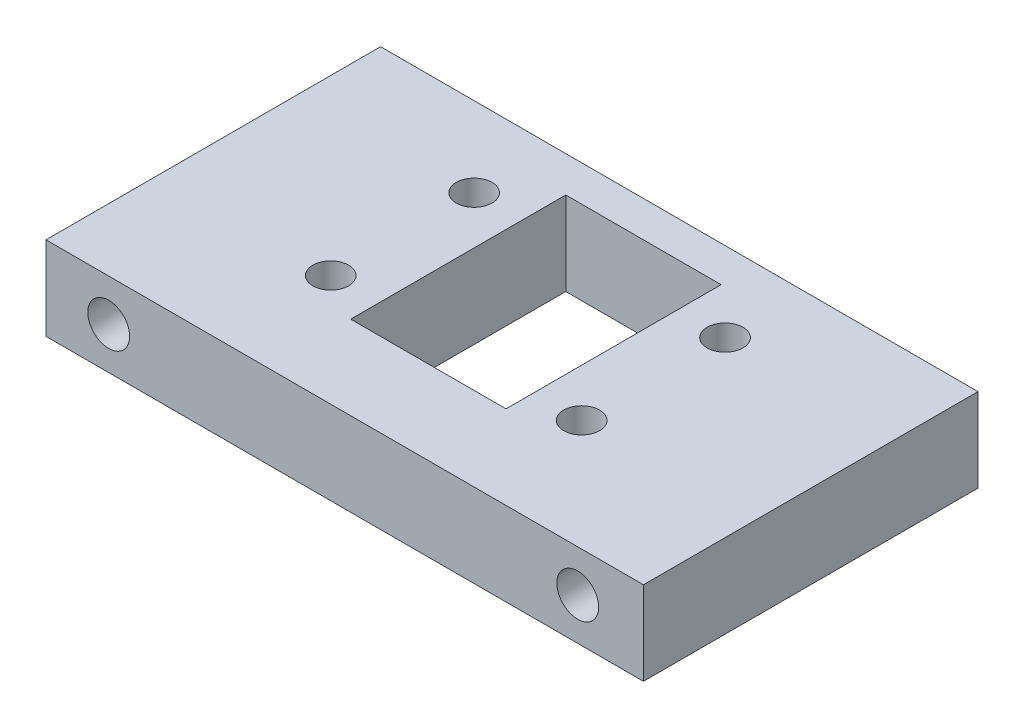
from build123d import *

# Parameters (mm, degrees)
ESQUISSE1_W             = 50
ESQUISSE1_H             = 7
BOSS_EXTRU_1_DEPTH      = 28
ESQUISSE2_R             = 1.75
ENL_V_MAT_EXTRU_2_DEPTH = 70
ESQUISSE3_R             = 1.5
ESQUISSE3_W             = 13
ESQUISSE3_H             = 18
ENL_V_MAT_EXTRU_3_DEPTH = 58.732140095


with BuildPart() as part:
    # Esquisse1 → Boss.-Extru.1 (new body)
    with BuildSketch(Plane.XY):
        with Locations((25, 3.5)):
            Rectangle(ESQUISSE1_W, ESQUISSE1_H)
    extrude(amount=BOSS_EXTRU_1_DEPTH)

    # Esquisse2 → Enlèv. mat.-Extru.2 (cut)
    with BuildSketch(Plane.XY.offset(28)):
        with Locations((5.25, 3.5)):
            Circle(ESQUISSE2_R)
        with Locations((44.5, 3.5)):
            Circle(ESQUISSE2_R)
    extrude(amount=-ENL_V_MAT_EXTRU_2_DEPTH, mode=Mode.SUBTRACT)

    # Esquisse3 → Enlèv. mat.-Extru.3 (cut, through all)
    with BuildSketch(Plane(origin=(0, 7, 0), x_dir=(1, 0, 0), z_dir=(0, 1, 0))):
        with Locations(Location((14.5, -6.67085961, 0), (0, 0, 270))):
            Circle(ESQUISSE3_R)
        with Locations(Location((14.5, -18.67085961, 0), (0, 0, 270))):
            Circle(ESQUISSE3_R)
        with Locations(Location((35.5, -6.67085961, 0), (0, 0, 270))):
            Circle(ESQUISSE3_R)
        with Locations(Location((35.5, -18.67085961, 0), (0, 0, 270))):
            Circle(ESQUISSE3_R)
        with Locations((25, -12)):
            Rectangle(ESQUISSE3_W, ESQUISSE3_H)
    extrude(amount=-ENL_V_MAT_EXTRU_3_DEPTH, mode=Mode.SUBTRACT)


solid = part.part
